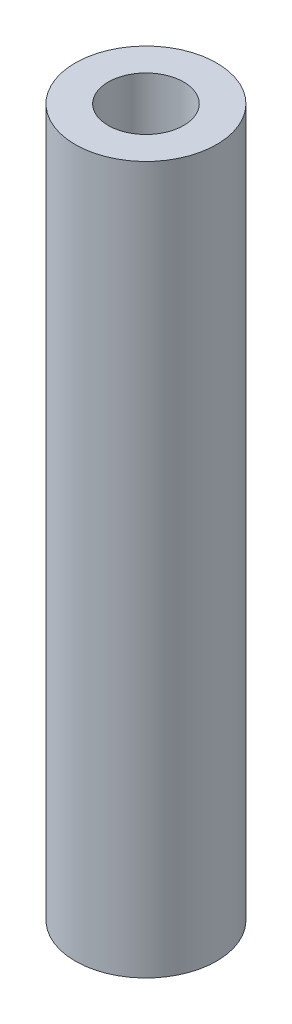
from build123d import *

# Parameters (mm, degrees)
SKETCH1_R            = 3
BOSS_EXTRUDE1_DEPTH  = 30
M3_CLEARANCE_HOLE1_D = 3.2


with BuildPart() as part:
    # Sketch1 → Boss-Extrude1 (new body)
    with BuildSketch(Plane(origin=(0, 0, 0), x_dir=(1, 0, 0), z_dir=(0, 1, 0))):
        with Locations(Location((0, 0, 0), (0, 0, 270))):
            Circle(SKETCH1_R)
    extrude(amount=BOSS_EXTRUDE1_DEPTH)

    # M3 Clearance Hole1 (through all)
    with Locations(Plane(origin=(0, 30, 0), x_dir=(1, 0, 0), z_dir=(0, 1, 0))):
        with Locations((0, 0)):
            Hole(M3_CLEARANCE_HOLE1_D / 2)


solid = part.part
